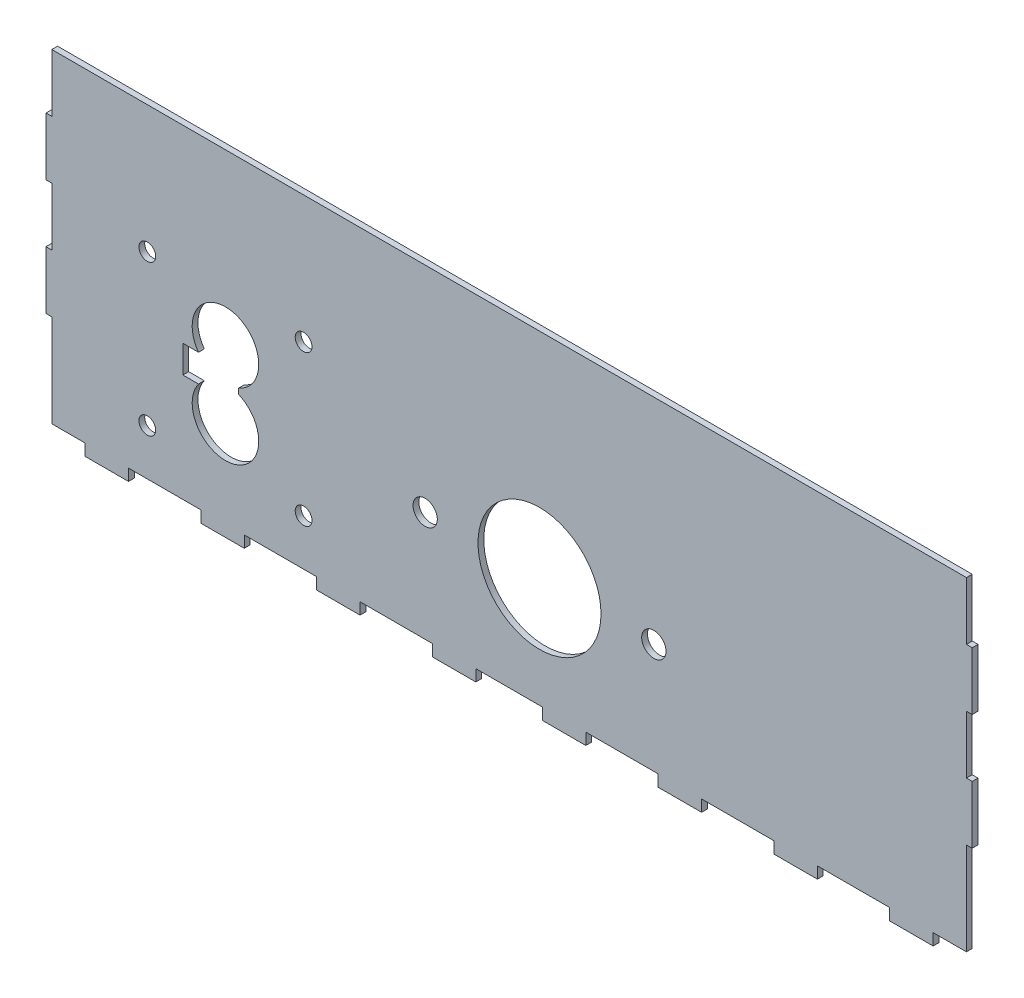
from build123d import *

# Parameters (mm, degrees)
SKETCH1_R               = 21.25
SKETCH1_R_2             = 4.2
SKETCH1_R_3             = 2.9
BOSS_EXTRUDE1_DEPTH     = 2
CUT_EXTRUDE1_DEPTH      = 171.89177862
CUT_EXTRUDE1_DEPTH_BACK = 171.89177862
SKETCH2_W               = 15
SKETCH2_H               = 2


with BuildPart() as part:
    # Sketch1 → Boss-Extrude1 (new body)
    with BuildSketch(Plane.XY):
        Polygon((-158, -56), (-146.5, -56), (-146.5, -60), (-131.5, -60), (-131.5, -56), (-106.5, -56), (-106.5, -60), (-91.5, -60), (-91.5, -56), (-66.5, -56), (-66.5, -60), (-51.5, -60), (-51.5, -56), (-26.5, -56), (-26.5, -60), (-11.5, -60), (-11.5, -56), (11.5, -56), (11.5, -60), (26.5, -60), (26.5, -56), (51.5, -56), (51.5, -60), (66.5, -60), (66.5, -56), (91.5, -56), (91.5, -60), (106.5, -60), (106.5, -56), (131.5, -56), (131.5, -60), (146.5, -60), (146.5, -56), (158, -56), (158, -24), (160, -24), (160, -4), (158, -4), (158, 16), (160, 16), (160, 36), (158, 36), (158, 56), (146.5, 56), (146.5, 58), (131.5, 58), (131.5, 56), (106.5, 56), (106.5, 58), (91.5, 58), (91.5, 56), (66.5, 56), (66.5, 58), (51.5, 58), (51.5, 56), (26.5, 56), (26.5, 58), (11.5, 58), (11.5, 56), (-11.5, 56), (-11.5, 58), (-26.5, 58), (-26.5, 56), (-51.5, 56), (-51.5, 58), (-66.5, 58), (-66.5, 56), (-91.5, 56), (-91.5, 58), (-106.5, 58), (-106.5, 56), (-131.5, 56), (-131.5, 58), (-146.5, 58), (-146.5, 56), (-158, 56), (-158, 36), (-160, 36), (-160, 16), (-158, 16), (-158, -4), (-160, -4), (-160, -24), (-158, -24), align=None)
        with Locations((10.5, -18)):
            Circle(SKETCH1_R, mode=Mode.SUBTRACT)
        with Locations((-29, -18)):
            Circle(SKETCH1_R_2, mode=Mode.SUBTRACT)
        with Locations((50, -18)):
            Circle(SKETCH1_R_2, mode=Mode.SUBTRACT)
        with Locations((-125, -40)):
            Circle(SKETCH1_R_3, mode=Mode.SUBTRACT)
        with Locations((-71, -40)):
            Circle(SKETCH1_R_3, mode=Mode.SUBTRACT)
        with Locations((-125, 12)):
            Circle(SKETCH1_R_3, mode=Mode.SUBTRACT)
        with Locations((-71, 12)):
            Circle(SKETCH1_R_3, mode=Mode.SUBTRACT)
        with BuildLine():
            Line((-93.5, -14.916994756), (-93.5, -13.083005244))
            ThreePointArc((-93.5, -13.083005244), (-94.924535841, 8.581133525), (-107.310612225, -9.25))
            Line((-107.310612225, -9.25), (-112.7, -9.25))
            Line((-112.7, -9.25), (-112.7, -18.75))
            Line((-112.7, -18.75), (-107.310612225, -18.75))
            ThreePointArc((-107.310612225, -18.75), (-94.924535841, -36.581133525), (-93.5, -14.916994756))
        make_face(mode=Mode.SUBTRACT)
    extrude(amount=BOSS_EXTRUDE1_DEPTH)

    # Sketch2 → Cut-Extrude1 (cut, two sides: drawn at the far end of the back side and taken through both)
    with BuildSketch(Plane.XY.offset(2).offset(-CUT_EXTRUDE1_DEPTH_BACK)):
        with Locations((-139, 57)):
            Rectangle(SKETCH2_W, SKETCH2_H)
        with Locations((-99, 57)):
            Rectangle(SKETCH2_W, SKETCH2_H)
        with Locations((-59, 57)):
            Rectangle(SKETCH2_W, SKETCH2_H)
        with Locations((-19, 57)):
            Rectangle(SKETCH2_W, SKETCH2_H)
        with Locations((19, 57)):
            Rectangle(SKETCH2_W, SKETCH2_H)
        with Locations((59, 57)):
            Rectangle(SKETCH2_W, SKETCH2_H)
        with Locations((99, 57)):
            Rectangle(SKETCH2_W, SKETCH2_H)
        with Locations((139, 57)):
            Rectangle(SKETCH2_W, SKETCH2_H)
    extrude(amount=CUT_EXTRUDE1_DEPTH + CUT_EXTRUDE1_DEPTH_BACK, mode=Mode.SUBTRACT)


solid = part.part
